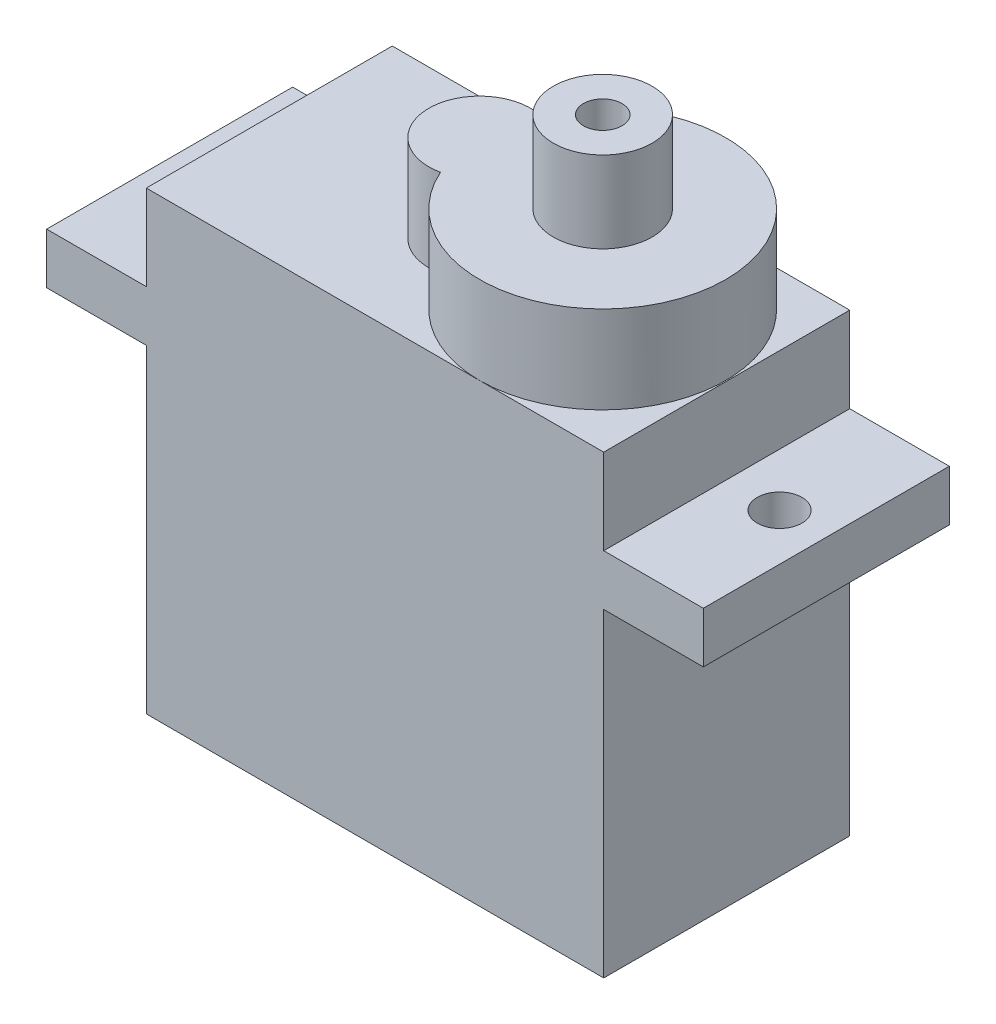
from build123d import *

# Parameters (mm, degrees)
SKETCH2_W           = 22.5
SKETCH2_H           = 12.1
BOSS_EXTRUDE1_DEPTH = 15.7
SKETCH3_W           = 32.3
SKETCH3_H           = 12.1
SKETCH3_R           = 1.1
BOSS_EXTRUDE2_DEPTH = 2.5
SKETCH4_W           = 22.5
SKETCH4_H           = 12.1
BOSS_EXTRUDE3_DEPTH = 4.2
BOSS_EXTRUDE4_DEPTH = 4.3
SKETCH6_R           = 2.43
SKETCH6_R_2         = 0.95
BOSS_EXTRUDE5_DEPTH = 4


with BuildPart() as part:
    # Sketch2 → Boss-Extrude1 (new body)
    with BuildSketch(Plane(origin=(0, 0, 0), x_dir=(1, 0, 0), z_dir=(0, 1, 0))):
        Rectangle(SKETCH2_W, SKETCH2_H)
    extrude(amount=BOSS_EXTRUDE1_DEPTH)

    # Sketch3 → Boss-Extrude2 (add)
    with BuildSketch(Plane(origin=(0, 15.7, 0), x_dir=(1, 0, 0), z_dir=(0, 1, 0))):
        Rectangle(SKETCH3_W, SKETCH3_H)
        with Locations(Location((-13.85, 0, 0), (0, 0, 270))):
            Circle(SKETCH3_R, mode=Mode.SUBTRACT)
        with Locations(Location((13.85, 0, 0), (0, 0, 270))):
            Circle(SKETCH3_R, mode=Mode.SUBTRACT)
    extrude(amount=BOSS_EXTRUDE2_DEPTH)

    # Sketch4 → Boss-Extrude3 (add)
    with BuildSketch(Plane(origin=(0, 18.2, 0), x_dir=(1, 0, 0), z_dir=(0, 1, 0))):
        Rectangle(SKETCH4_W, SKETCH4_H)
    extrude(amount=BOSS_EXTRUDE3_DEPTH)

    # Sketch5 → Boss-Extrude4 (add)
    with BuildSketch(Plane(origin=(0, 22.4, 0), x_dir=(1, 0, 0), z_dir=(0, 1, 0))):
        with BuildLine():
            ThreePointArc((-0.383471074, -2.446057618), (11.2, 0), (-0.383471074, 2.446057618))
            ThreePointArc((-0.383471074, 2.446057618), (-3.4, 0), (-0.383471074, -2.446057618))
        make_face()
    extrude(amount=BOSS_EXTRUDE4_DEPTH)

    # Sketch6 → Boss-Extrude5 (add)
    with BuildSketch(Plane(origin=(0, 26.7, 0), x_dir=(1, 0, 0), z_dir=(0, 1, 0))):
        with Locations(Location((5.15, 0, 0), (0, 0, 270))):
            Circle(SKETCH6_R)
        with Locations(Location((5.15, 0, 0), (0, 0, 270))):
            Circle(SKETCH6_R_2, mode=Mode.SUBTRACT)
    extrude(amount=BOSS_EXTRUDE5_DEPTH)


solid = part.part
